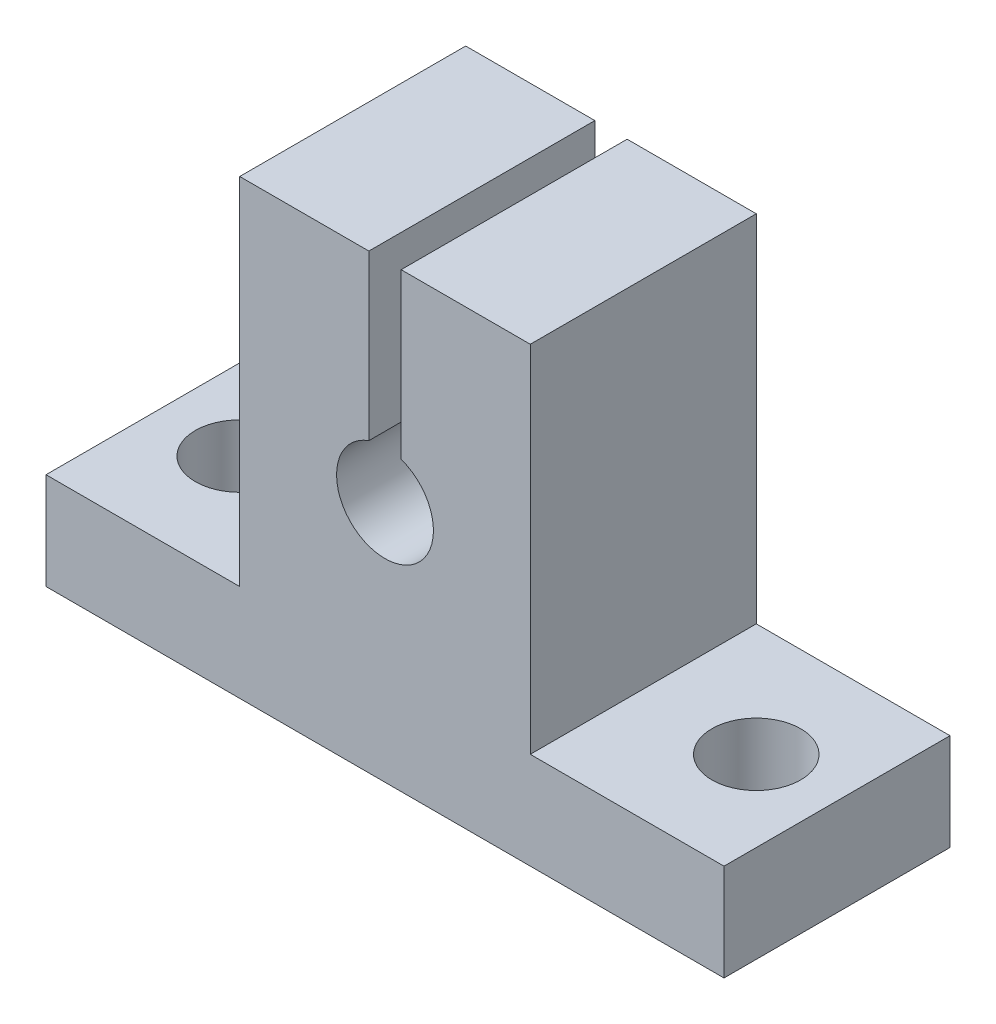
from build123d import *

# Parameters (mm, degrees)
EXTRUDE_1_DEPTH     = 14
SKETCH_2_R          = 2.75
CUT_EXTRUDE_1_DEPTH = 34.481338086


with BuildPart() as part:
    # 草图1 → 凸台-拉伸1 (new body)
    with BuildSketch(Plane.XY):
        with BuildLine():
            Line((-1, 0), (-9, 0))
            Line((-9, 0), (-9, -22))
            Line((-9, -22), (-21, -22))
            Line((-21, -22), (-21, -28))
            Line((-21, -28), (21, -28))
            Line((21, -28), (21, -22))
            Line((21, -22), (9, -22))
            Line((9, -22), (9, 0))
            Line((9, 0), (1, 0))
            Line((1, 0), (1, -10.171572875))
            ThreePointArc((1, -10.171572875), (0, -16), (-1, -10.171572875))
            Line((-1, -10.171572875), (-1, 0))
        make_face()
    extrude(amount=EXTRUDE_1_DEPTH)

    # 草图2 → 切除-拉伸1 (cut, through all)
    with BuildSketch(Plane(origin=(0, -22, 0), x_dir=(1, 0, 0), z_dir=(0, 1, 0))):
        with Locations(Location((-16, -7, 0), (0, 0, 180))):
            Circle(SKETCH_2_R)
        with Locations(Location((16, -7, 0), (0, 0, 180))):
            Circle(SKETCH_2_R)
    extrude(amount=-CUT_EXTRUDE_1_DEPTH, mode=Mode.SUBTRACT)


solid = part.part
